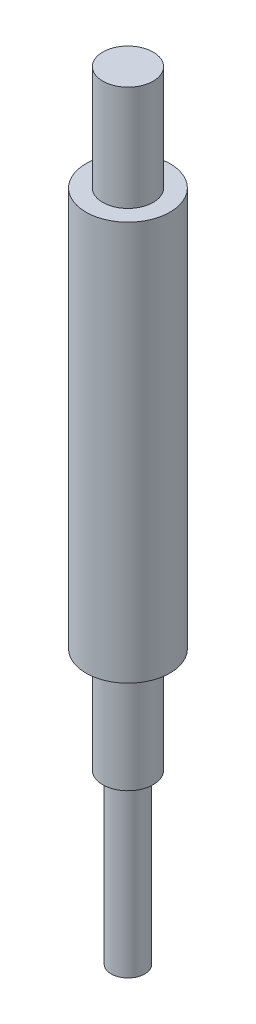
from build123d import *

# Parameters (mm, degrees)
SKETCH_2_R      = 4
EXTRUDE_1_DEPTH = 40
SKETCH_3_R      = 6
EXTRUDE_3_DEPTH = 25
SKETCH_4_R      = 10
EXTRUDE_4_DEPTH = 95
SKETCH_5_R      = 6
EXTRUDE_5_DEPTH = 25


with BuildPart() as part:
    # Эскиз2 → Бобышка-Вытянуть1 (new body)
    with BuildSketch(Plane(origin=(0, 0, 0), x_dir=(1, 0, 0), z_dir=(0, 1, 0))):
        with Locations(Location((0, 0, 0), (0, 0, 270))):
            Circle(SKETCH_2_R)
    extrude(amount=EXTRUDE_1_DEPTH)

    # Эскиз3 → Бобышка-Вытянуть3 (add)
    with BuildSketch(Plane(origin=(0, 40, 0), x_dir=(1, 0, 0), z_dir=(0, 1, 0))):
        with Locations(Location((0, 0, 0), (0, 0, 270))):
            Circle(SKETCH_3_R)
    extrude(amount=EXTRUDE_3_DEPTH)

    # Эскиз4 → Бобышка-Вытянуть4 (add)
    with BuildSketch(Plane(origin=(0, 65, 0), x_dir=(1, 0, 0), z_dir=(0, 1, 0))):
        with Locations(Location((0, 0, 0), (0, 0, 270))):
            Circle(SKETCH_4_R)
    extrude(amount=EXTRUDE_4_DEPTH)

    # Эскиз5 → Бобышка-Вытянуть5 (add)
    with BuildSketch(Plane(origin=(0, 160, 0), x_dir=(1, 0, 0), z_dir=(0, 1, 0))):
        with Locations(Location((0, 0, 0), (0, 0, 270))):
            Circle(SKETCH_5_R)
    extrude(amount=EXTRUDE_5_DEPTH)


solid = part.part
